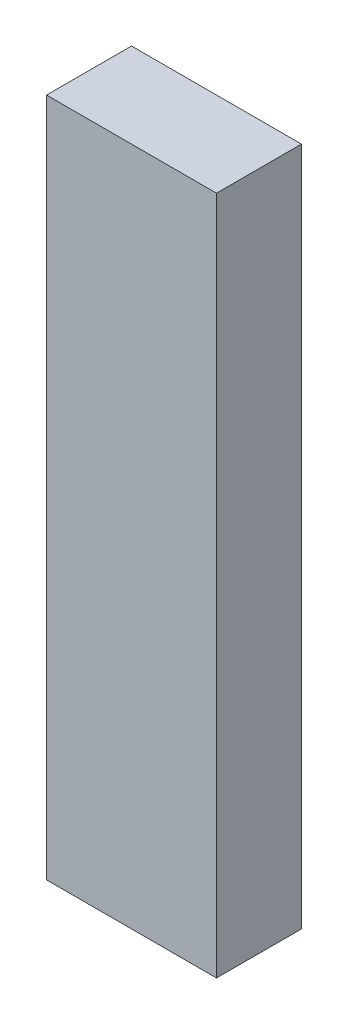
from build123d import *

# Parameters (mm, degrees)
ESQUISSE1_W        = 10
ESQUISSE1_H        = 40
BOSS_EXTRU_1_DEPTH = 5


with BuildPart() as part:
    # Esquisse1 → Boss.-Extru.1 (new body)
    with BuildSketch(Plane.XY):
        with Locations((5, 20)):
            Rectangle(ESQUISSE1_W, ESQUISSE1_H)
    extrude(amount=BOSS_EXTRU_1_DEPTH)


solid = part.part
